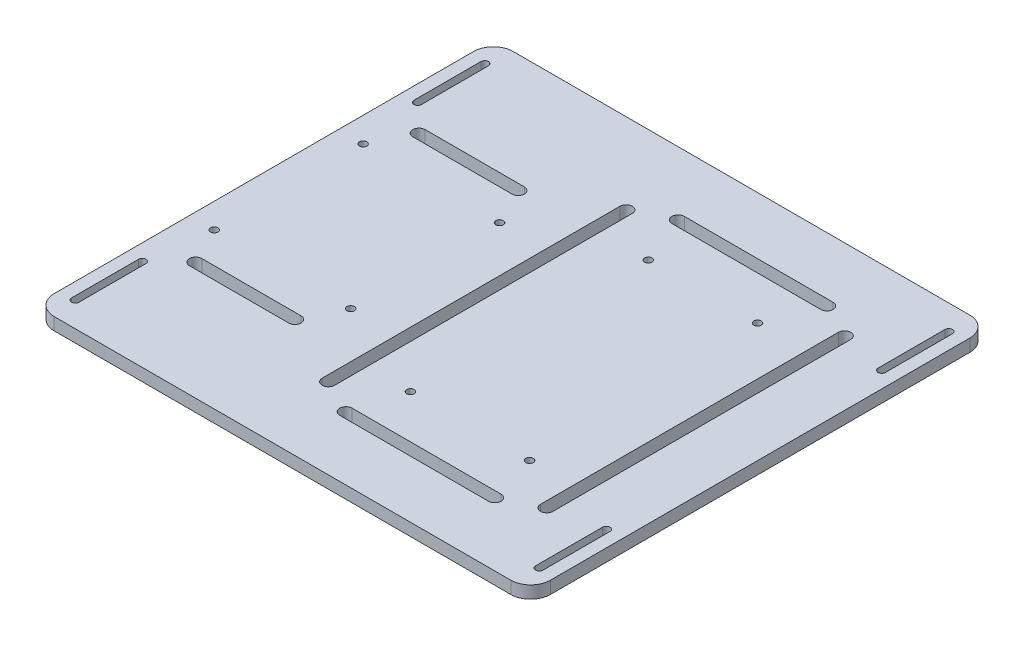
from build123d import *

# Parameters (mm, degrees)
SKETCH2_W           = 200
SKETCH2_H           = 185
BOSS_EXTRUDE1_DEPTH = 5
SKETCH3_R           = 1.5
CUT_EXTRUDE1_DEPTH  = 137.313058802
SKETCH4_R           = 1.5
CUT_EXTRUDE3_DEPTH  = 137.313058802
FILLET1_R           = 8


with BuildPart() as part:
    # Sketch2 → Boss-Extrude1 (new body)
    with BuildSketch(Plane(origin=(0, 0, 0), x_dir=(1, 0, 0), z_dir=(0, 1, 0))):
        Rectangle(SKETCH2_W, SKETCH2_H)
        with BuildLine():
            Line((-95, 55.5), (-95, 82.5))
            ThreePointArc((-95, 82.5), (-93.5, 84), (-92, 82.5))
            Line((-92, 82.5), (-92, 55.5))
            ThreePointArc((-92, 55.5), (-93.5, 54), (-95, 55.5))
        make_face(mode=Mode.SUBTRACT)
        with BuildLine():
            Line((95, 55.5), (95, 82.5))
            ThreePointArc((95, 82.5), (93.5, 84), (92, 82.5))
            Line((92, 82.5), (92, 55.5))
            ThreePointArc((92, 55.5), (93.5, 54), (95, 55.5))
        make_face(mode=Mode.SUBTRACT)
        with BuildLine():
            Line((95, -55.5), (95, -82.5))
            ThreePointArc((95, -82.5), (93.5, -84), (92, -82.5))
            Line((92, -82.5), (92, -55.5))
            ThreePointArc((92, -55.5), (93.5, -54), (95, -55.5))
        make_face(mode=Mode.SUBTRACT)
        with BuildLine():
            Line((-95, -55.5), (-95, -82.5))
            ThreePointArc((-95, -82.5), (-93.5, -84), (-92, -82.5))
            Line((-92, -82.5), (-92, -55.5))
            ThreePointArc((-92, -55.5), (-93.5, -54), (-95, -55.5))
        make_face(mode=Mode.SUBTRACT)
    extrude(amount=BOSS_EXTRUDE1_DEPTH)

    # Sketch3 → Cut-Extrude1 (cut, through all)
    with BuildSketch(Plane(origin=(0, 5, 0), x_dir=(1, 0, 0), z_dir=(0, 1, 0))):
        with BuildLine():
            Line((-82.5, 42.5), (-42.5, 42.5))
            ThreePointArc((-42.5, 42.5), (-40, 45), (-42.5, 47.5))
            Line((-42.5, 47.5), (-82.5, 47.5))
            ThreePointArc((-82.5, 47.5), (-85, 45), (-82.5, 42.5))
        make_face()
        with BuildLine():
            ThreePointArc((-42.5, -42.5), (-40, -45), (-42.5, -47.5))
            Line((-42.5, -47.5), (-82.5, -47.5))
            ThreePointArc((-82.5, -47.5), (-85, -45), (-82.5, -42.5))
            Line((-82.5, -42.5), (-42.5, -42.5))
        make_face()
        with Locations(Location((-90, -30, 0), (0, 0, 270))):
            Circle(SKETCH3_R)
        with Locations(Location((-90, 30, 0), (0, 0, 90))):
            Circle(SKETCH3_R)
        with Locations(Location((-35, -30, 0), (0, 0, 90))):
            Circle(SKETCH3_R)
        with Locations(Location((-35, 30, 0), (0, 0, 270))):
            Circle(SKETCH3_R)
    extrude(amount=-CUT_EXTRUDE1_DEPTH, mode=Mode.SUBTRACT)

    # Sketch4 → Cut-Extrude3 (cut, through all)
    with BuildSketch(Plane(origin=(0, 5, 0), x_dir=(1, 0, 0), z_dir=(0, 1, 0))):
        with Locations(Location((8, 46.935, 0), (0, 0, 270))):
            Circle(SKETCH4_R)
        with Locations(Location((52, 46.935, 0), (0, 0, 90))):
            Circle(SKETCH4_R)
        with Locations(Location((6, -46.935, 0), (0, 0, 270))):
            Circle(SKETCH4_R)
        with Locations(Location((54, -46.935, 0), (0, 0, 90))):
            Circle(SKETCH4_R)
        with BuildLine():
            Line((71.5, -60), (71.5, 60))
            ThreePointArc((71.5, 60), (74, 62.5), (76.5, 60))
            Line((76.5, 60), (76.5, -60))
            ThreePointArc((76.5, -60), (74, -62.5), (71.5, -60))
        make_face()
        with BuildLine():
            Line((-16.5, -60), (-16.5, 60))
            ThreePointArc((-16.5, 60), (-14, 62.5), (-11.5, 60))
            Line((-11.5, 60), (-11.5, -60))
            ThreePointArc((-11.5, -60), (-14, -62.5), (-16.5, -60))
        make_face()
        with BuildLine():
            Line((0, 69.435), (60, 69.435))
            ThreePointArc((60, 69.435), (62.5, 66.935), (60, 64.435))
            Line((60, 64.435), (0, 64.435))
            ThreePointArc((0, 64.435), (-2.5, 66.935), (0, 69.435))
        make_face()
        with BuildLine():
            Line((0, -69.435), (60, -69.435))
            ThreePointArc((60, -69.435), (62.5, -66.935), (60, -64.435))
            Line((60, -64.435), (0, -64.435))
            ThreePointArc((0, -64.435), (-2.5, -66.935), (0, -69.435))
        make_face()
    extrude(amount=-CUT_EXTRUDE3_DEPTH, mode=Mode.SUBTRACT)

    # Fillet1
    fillet1_edges = [part.edges().sort_by_distance(p)[0] for p in [
        (100, 2.5, 92.5),
        (-100, 2.5, 92.5),
        (-100, 2.5, -92.5),
        (100, 2.5, -92.5),
    ]]
    fillet(fillet1_edges, radius=FILLET1_R)


solid = part.part
